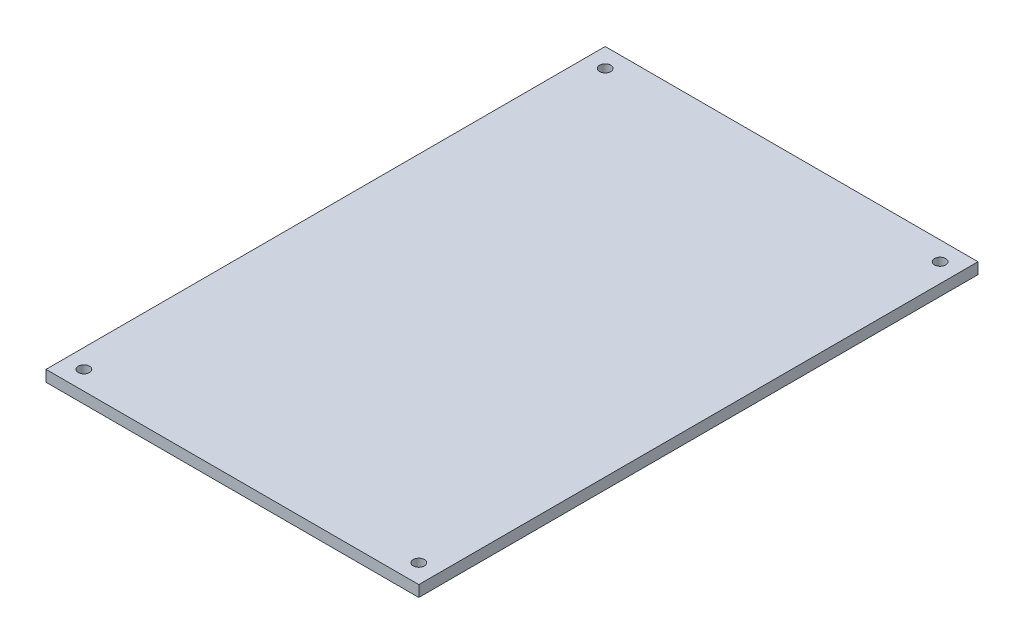
from build123d import *

# Parameters (mm, degrees)
SKETCH1_W           = 99.999999898
SKETCH1_H           = 149.999999974
BOSS_EXTRUDE1_DEPTH = 3
SKETCH2_R           = 1.500000048
SKETCH2_R_2         = 1.5
CUT_EXTRUDE1_DEPTH  = 3


with BuildPart() as part:
    # Sketch1 → Boss-Extrude1 (new body)
    with BuildSketch(Plane(origin=(0, 0, 0), x_dir=(1, 0, 0), z_dir=(0, 1, 0))):
        Rectangle(SKETCH1_W, SKETCH1_H)
    extrude(amount=BOSS_EXTRUDE1_DEPTH)

    # Sketch2 → Cut-Extrude1 (cut)
    with BuildSketch(Plane(origin=(0, 3, 0), x_dir=(1, 0, 0), z_dir=(0, 1, 0))):
        with Locations(Location((-44.919999949, 69.919999987, 0), (0, 0, 270))):
            Circle(SKETCH2_R)
        with Locations(Location((44.919999949, 69.919999987, 0), (0, 0, 270))):
            Circle(SKETCH2_R_2)
        with Locations(Location((-44.919999949, -69.919999987, 0), (0, 0, 270))):
            Circle(SKETCH2_R_2)
        with Locations(Location((44.919999949, -69.919999987, 0), (0, 0, 270))):
            Circle(SKETCH2_R_2)
    extrude(amount=-CUT_EXTRUDE1_DEPTH, mode=Mode.SUBTRACT)


solid = part.part
